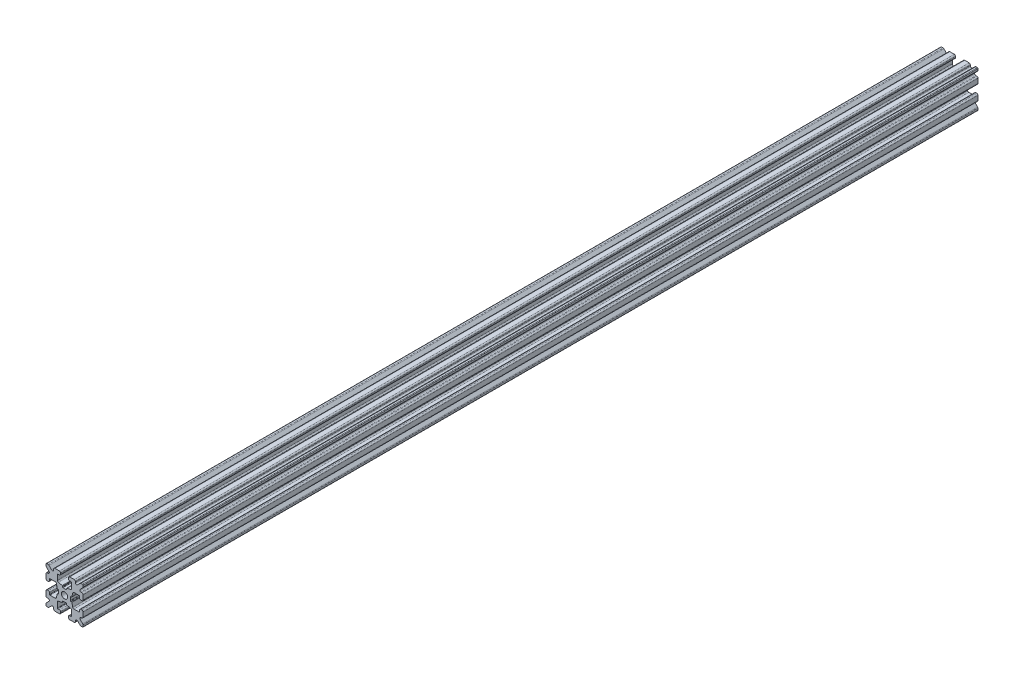
from build123d import *

# Parameters (mm, degrees)
SKETCH1_W           = 15
SKETCH1_H           = 15
SKETCH1_R           = 1.25
BOSS_EXTRUDE1_DEPTH = 181
FILLET1_R           = 0.25
CUT_EXTRUDE1_DEPTH  = 363.155353405
CUT_EXTRUDE3_DEPTH  = 363.155353405
FILLET3_R           = 0.5
FILLET4_R           = 0.5
FILLET5_R           = 3
FILLET6_R           = 0.2
CUT_EXTRUDE4_DEPTH  = 363.155353405
FILLET8_R           = 0.5
SKETCH6_W           = 5.1529354
SKETCH6_H           = 1.651
SKETCH6_W_2         = 1.651
SKETCH6_H_2         = 5.1529354
CUT_EXTRUDE5_DEPTH  = 363.155353405
FILLET10_R          = 0.2


with BuildPart() as part:
    # Sketch1 → Boss-Extrude1 (new, symmetric)
    with BuildSketch(Plane.XY):
        Rectangle(SKETCH1_W, SKETCH1_H)
        Circle(SKETCH1_R, mode=Mode.SUBTRACT)
    extrude(amount=BOSS_EXTRUDE1_DEPTH, both=True)

    # Fillet1
    fillet1_edges = [part.edges().sort_by_distance(p)[0] for p in [
        (7.5, -7.5, 0),
        (-7.5, -7.5, 0),
        (-7.5, 7.5, 0),
        (7.5, 7.5, 0),
    ]]
    fillet(fillet1_edges, radius=FILLET1_R)

    # Sketch2 → Cut-Extrude1 (cut, through all)
    with BuildSketch(Plane.XY.offset(181)):
        Polygon((-7.5, 1.6), (-6.1, 1.6), (-6.1, 2.9), (-3.4, 2.9), (-3.4, -2.9), (-6.1, -2.9), (-6.1, -1.6), (-7.5, -1.6), align=None)
        Polygon((2.9, 6.1), (1.6, 6.1), (1.6, 7.5), (-1.6, 7.5), (-1.6, 6.1), (-2.9, 6.1), (-2.9, 3.4), (2.9, 3.4), align=None)
        Polygon((-1.6, -7.5), (-1.6, -6.1), (-2.9, -6.1), (-2.9, -3.4), (2.9, -3.4), (2.9, -6.1), (1.6, -6.1), (1.6, -7.5), align=None)
        Polygon((6.1, -2.9), (6.1, -1.6), (7.5, -1.6), (7.5, 1.6), (6.1, 1.6), (6.1, 2.9), (3.4, 2.9), (3.4, -2.9), align=None)
    extrude(amount=-CUT_EXTRUDE1_DEPTH, mode=Mode.SUBTRACT)

    # Sketch4 → Cut-Extrude3 (cut, through all)
    with BuildSketch(Plane.XY.offset(181)):
        Polygon((-3.4, 2.9), (-2.75, 0), (-3.4, -2.9), align=None)
        Polygon((-2.9, 3.4), (0, 2.75), (2.9, 3.4), align=None)
        Polygon((3.4, 2.9), (2.75, 0), (3.4, -2.9), align=None)
        Polygon((-2.9, -3.4), (0, -2.75), (2.9, -3.4), align=None)
    extrude(amount=-CUT_EXTRUDE3_DEPTH, mode=Mode.SUBTRACT)

    # Fillet3
    fillet3_edges = [part.edges().sort_by_distance(p)[0] for p in [
        (1.6, -7.5, 0),
        (-1.6, -7.5, 0),
        (-1.6, -6.1, 0),
        (1.6, -6.1, 0),
        (6.1, 1.6, 0),
        (7.5, 1.6, 0),
        (7.5, -1.6, 0),
        (6.1, -1.6, 0),
        (-7.5, -1.6, 0),
        (-7.5, 1.6, 0),
        (-6.1, 1.6, 0),
        (-6.1, -1.6, 0),
        (-1.6, 6.1, 0),
        (-1.6, 7.5, 0),
        (1.6, 7.5, 0),
        (1.6, 6.1, 0),
    ]]
    fillet(fillet3_edges, radius=FILLET3_R)

    # Fillet4
    fillet4_edges = [part.edges().sort_by_distance(p)[0] for p in [
        (-2.9, -3.4, 0),
        (2.9, -3.4, 0),
        (3.4, -2.9, 0),
        (3.4, 2.9, 0),
        (-3.4, 2.9, 0),
        (-3.4, -2.9, 0),
        (2.9, 3.4, 0),
        (-2.9, 3.4, 0),
    ]]
    fillet(fillet4_edges, radius=FILLET4_R)

    # Fillet5
    fillet5_edges = [part.edges().sort_by_distance(p)[0] for p in [
        (-2.75, 0, 0),
        (0, 2.75, 0),
        (2.75, 0, 0),
        (0, -2.75, 0),
    ]]
    fillet(fillet5_edges, radius=FILLET5_R)

    # Fillet6
    fillet6_edges = [part.edges().sort_by_distance(p)[0] for p in [
        (-2.9, -6.1, 0),
        (2.9, -6.1, 0),
        (6.1, -2.9, 0),
        (6.1, 2.9, 0),
        (-6.1, 2.9, 0),
        (-6.1, -2.9, 0),
        (2.9, 6.1, 0),
        (-2.9, 6.1, 0),
    ]]
    fillet(fillet6_edges, radius=FILLET6_R)

    # Sketch5 → Cut-Extrude4 (cut, through all)
    with BuildSketch(Plane.XY.offset(181)):
        Polygon((-7.5, 6.439339828), (-5.460660172, 4.4), (-7.5, 4.4), align=None)
        Polygon((-6.439339828, 7.5), (-4.4, 5.460660172), (-4.4, 7.5), align=None)
        Polygon((4.4, 7.5), (6.439339828, 7.5), (4.4, 5.460660172), align=None)
        Polygon((7.5, 6.439339828), (7.5, 4.4), (5.460660172, 4.4), align=None)
        Polygon((7.5, -6.439339828), (5.460660172, -4.4), (7.5, -4.4), align=None)
        Polygon((6.439339828, -7.5), (4.4, -5.460660172), (4.4, -7.5), align=None)
        Polygon((-4.4, -7.5), (-6.439339828, -7.5), (-4.4, -5.460660172), align=None)
        Polygon((-7.5, -6.439339828), (-7.5, -4.4), (-5.460660172, -4.4), align=None)
    extrude(amount=-CUT_EXTRUDE4_DEPTH, mode=Mode.SUBTRACT)

    # Fillet8
    fillet8_edges = [part.edges().sort_by_distance(p)[0] for p in [
        (-7.5, 4.4, 0),
        (-7.5, 6.439339828, 0),
        (-5.460660172, 4.4, 0),
        (7.5, -4.4, 0),
        (7.5, -6.439339828, 0),
        (5.460660172, -4.4, 0),
        (5.460660172, 4.4, 0),
        (7.5, 6.439339828, 0),
        (7.5, 4.4, 0),
        (-4.4, 7.5, 0),
        (-4.4, 5.460660172, 0),
        (-6.439339828, 7.5, 0),
        (-5.460660172, -4.4, 0),
        (-7.5, -6.439339828, 0),
        (-7.5, -4.4, 0),
        (4.4, 5.460660172, 0),
        (4.4, 7.5, 0),
        (6.439339828, 7.5, 0),
        (6.439339828, -7.5, 0),
        (4.4, -7.5, 0),
        (4.4, -5.460660172, 0),
        (-6.439339828, -7.5, 0),
        (-4.4, -5.460660172, 0),
        (-4.4, -7.5, 0),
    ]]
    fillet(fillet8_edges, radius=FILLET8_R)

    # Sketch6 → Cut-Extrude5 (cut, through all)
    with BuildSketch(Plane.XY.offset(181)):
        with Locations((4.9235323, 0)):
            Rectangle(SKETCH6_W, SKETCH6_H)
        with Locations((0, -4.9235323)):
            Rectangle(SKETCH6_W_2, SKETCH6_H_2)
        with Locations((-4.9235323, 0)):
            Rectangle(SKETCH6_W, SKETCH6_H)
        with Locations((0, 4.9235323)):
            Rectangle(SKETCH6_W_2, SKETCH6_H_2)
    extrude(amount=-CUT_EXTRUDE5_DEPTH, mode=Mode.SUBTRACT)

    # Fillet10
    fillet10_edges = [part.edges().sort_by_distance(p)[0] for p in [
        (0.8255, -2.935025862, 0),
        (-0.8255, -2.935025862, 0),
        (0.8255, -2.3470646, 0),
        (-0.8255, -2.3470646, 0),
        (2.935025862, 0.8255, 0),
        (2.935025862, -0.8255, 0),
        (2.3470646, 0.8255, 0),
        (2.3470646, -0.8255, 0),
        (-2.935025862, -0.8255, 0),
        (-2.935025862, 0.8255, 0),
        (-2.3470646, -0.8255, 0),
        (-2.3470646, 0.8255, 0),
        (-0.8255, 2.935025862, 0),
        (0.8255, 2.935025862, 0),
        (-0.8255, 2.3470646, 0),
        (0.8255, 2.3470646, 0),
    ]]
    fillet(fillet10_edges, radius=FILLET10_R)


solid = part.part
